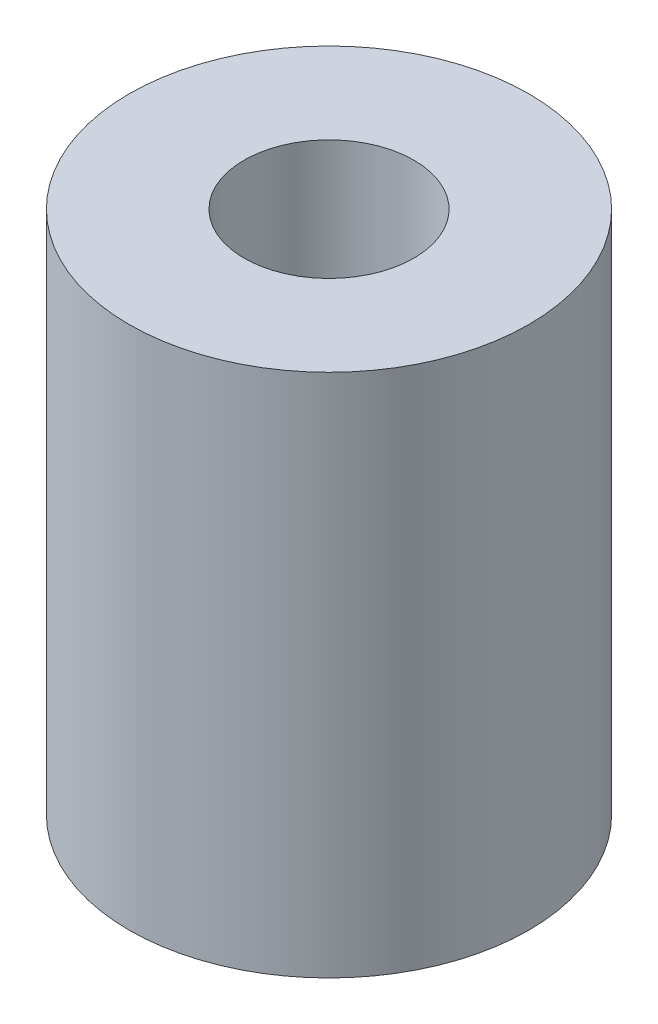
from build123d import *

# Parameters (mm, degrees)
SKETCH_1_R        = 4
EXTRUDE_1_DEPTH   = 10.5
HOLE_WIZARD_M31_D = 3.4


with BuildPart() as part:
    # Эскиз1 → Бобышка-Вытянуть1 (new body)
    with BuildSketch(Plane(origin=(0, 0, 0), x_dir=(1, 0, 0), z_dir=(0, 1, 0))):
        with Locations(Location((0, 0, 0), (0, 0, 90))):
            Circle(SKETCH_1_R)
    extrude(amount=EXTRUDE_1_DEPTH)

    # Отверстие с зазором M31 (through all)
    with Locations(Plane(origin=(0, 0, 0), x_dir=(-1, 0, 0), z_dir=(0, -1, 0))):
        with Locations((0, 0)):
            Hole(HOLE_WIZARD_M31_D / 2)


solid = part.part
